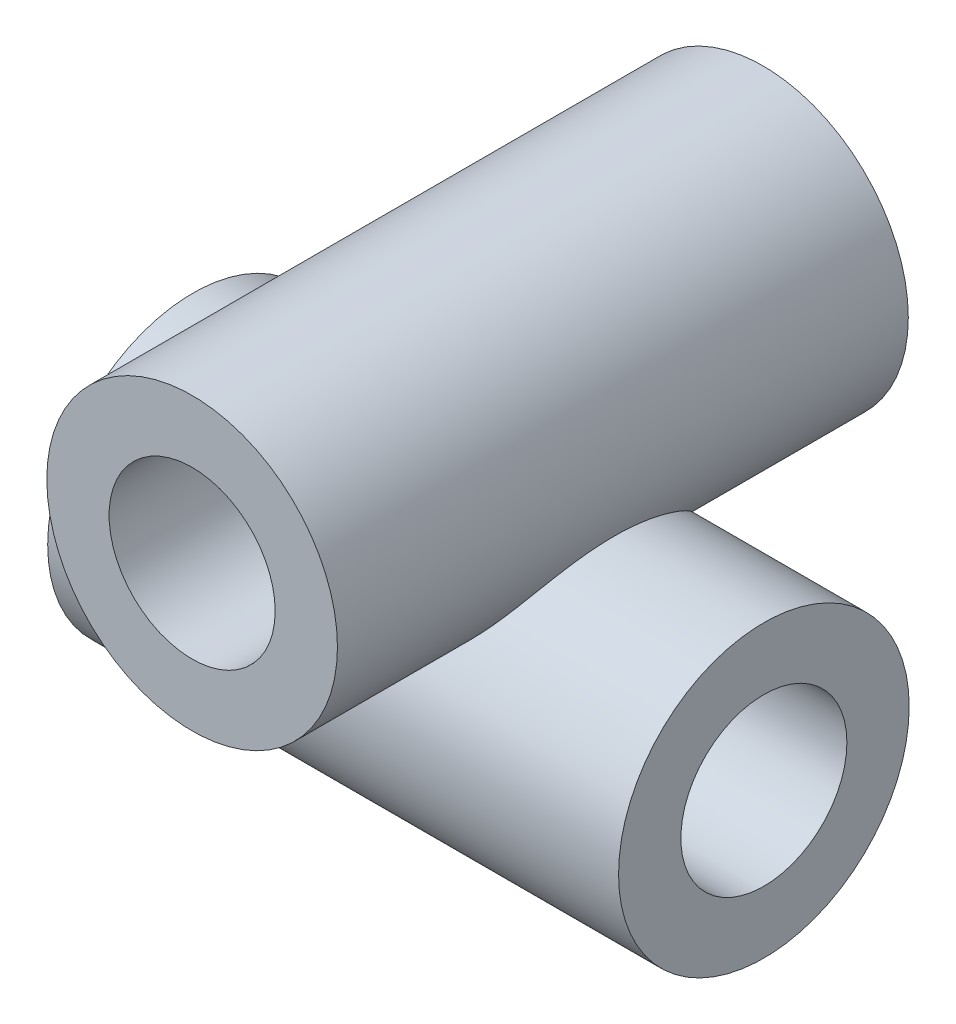
from build123d import *

# Parameters (mm, degrees)
SKETCH1_R           = 28
BOSS_EXTRUDE1_DEPTH = 110
SKETCH3_R           = 28
BOSS_EXTRUDE2_DEPTH = 55
SKETCH4_R           = 16
CUT_EXTRUDE1_DEPTH  = 140.57435311
SKETCH6_R           = 16
CUT_EXTRUDE2_DEPTH  = 169.985206622


with BuildPart() as part:
    # Sketch1 → Boss-Extrude1 (new body)
    with BuildSketch(Plane.XY):
        Circle(SKETCH1_R)
    extrude(amount=BOSS_EXTRUDE1_DEPTH)

    # Sketch3 → Boss-Extrude2 (add, symmetric)
    with BuildSketch(Plane(origin=(0, 0, 0), x_dir=(0, 0, -1), z_dir=(1, 0, 0))):
        with Locations((-54.831273686, -38)):
            Circle(SKETCH3_R)
    extrude(amount=BOSS_EXTRUDE2_DEPTH, both=True)

    # Sketch4 → Cut-Extrude1 (cut, through all)
    with BuildSketch(Plane.XY.offset(110)):
        Circle(SKETCH4_R)
    extrude(amount=-CUT_EXTRUDE1_DEPTH, mode=Mode.SUBTRACT)

    # Sketch6 → Cut-Extrude2 (cut, through all)
    with BuildSketch(Plane(origin=(55, 0, 0), x_dir=(0, 0, -1), z_dir=(1, 0, 0))):
        with Locations((-54.831273686, -38)):
            Circle(SKETCH6_R)
    extrude(amount=-CUT_EXTRUDE2_DEPTH, mode=Mode.SUBTRACT)


solid = part.part
